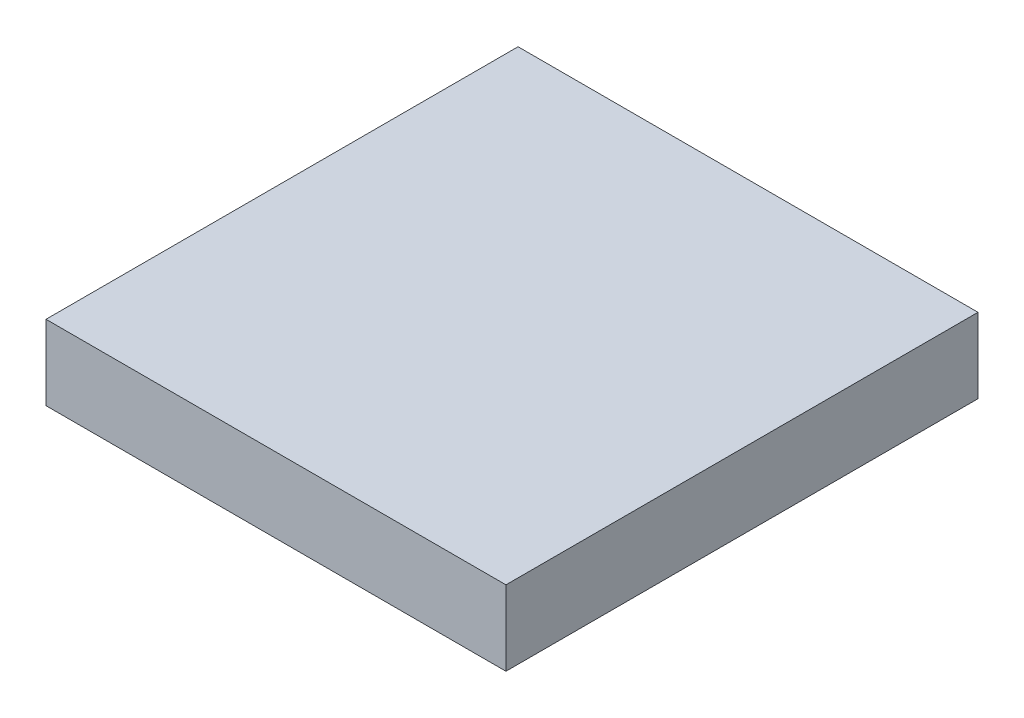
from build123d import *

# Parameters (mm, degrees)
SKETCH1_W           = 30.721788298
SKETCH1_H           = 31.53025641
BOSS_EXTRUDE1_DEPTH = 5


with BuildPart() as part:
    # Sketch1 → Boss-Extrude1 (new body)
    with BuildSketch(Plane(origin=(0, 0, 0), x_dir=(1, 0, 0), z_dir=(0, 1, 0))):
        Rectangle(SKETCH1_W, SKETCH1_H)
    extrude(amount=BOSS_EXTRUDE1_DEPTH)


solid = part.part
